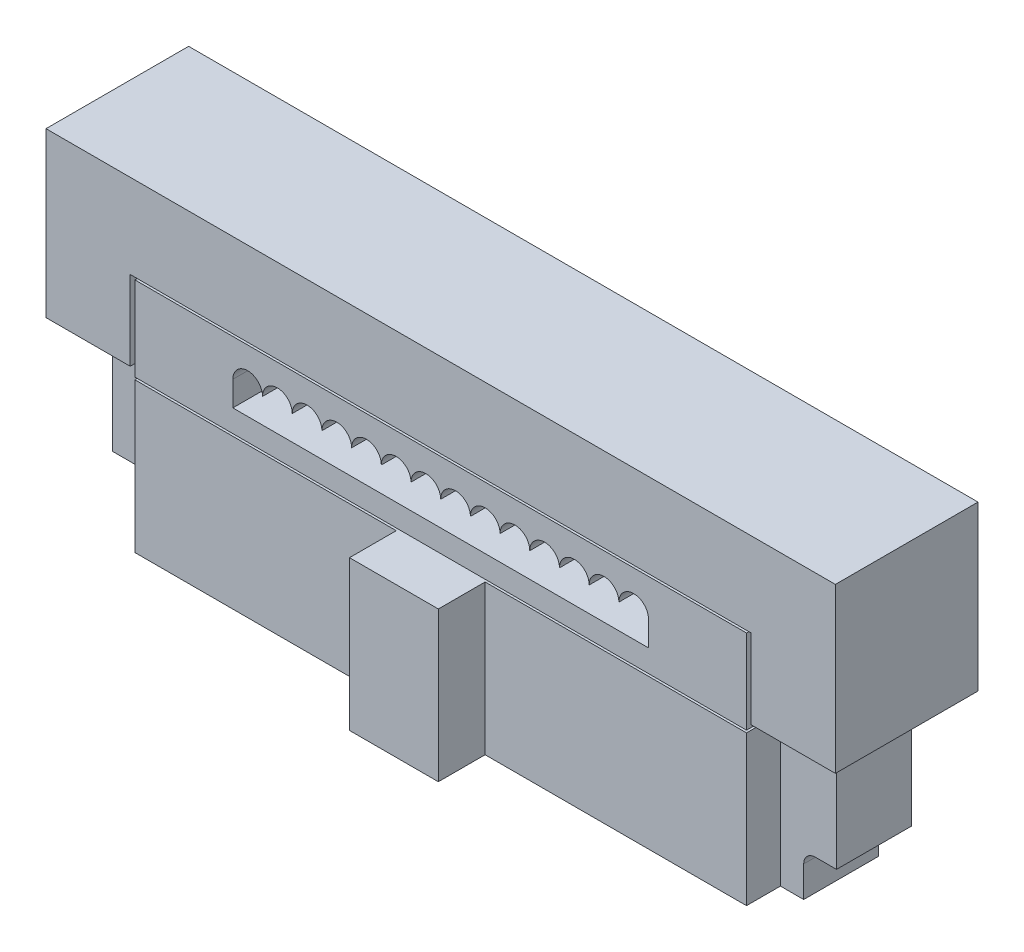
from build123d import *

# Parameters (mm, degrees)
SKETCH1_W            = 13.08
SKETCH1_H            = 3.2
BOSS_EXTRUDE1_DEPTH  = 3.05
BOSS_EXTRUDE2_START  = -0.725
BOSS_EXTRUDE2_DEPTH  = 1.6
SKETCH4_W            = 1.9
SKETCH4_H            = 3.2
POLARIZING_KEY_DEPTH = 1
SKETCH5_W            = 13.08
SKETCH5_H            = 1.8
CABLE_CLIP_DEPTH     = 3.05
BOSS_EXTRUDE5_REACH  = 12.496


with BuildPart() as part:
    # Sketch1 → Boss-Extrude1 (new body)
    with BuildSketch(Plane.XY):
        with Locations((0, 1.6)):
            Rectangle(SKETCH1_W, SKETCH1_H)
    extrude(amount=-BOSS_EXTRUDE1_DEPTH)

    # Sketch2 → Boss-Extrude2 (add)
    with BuildSketch(Plane.XY.offset(BOSS_EXTRUDE2_START)):
        with BuildLine():
            Line((6.54, 0), (7.037478352, 0))
            Line((7.037478352, 0), (7.037478352, 0.659767292))
            ThreePointArc((7.037478352, 0.659767292), (7.110701657, 0.836543987), (7.287478352, 0.909767292))
            Line((7.287478352, 0.909767292), (7.74, 0.909767292))
            Line((7.74, 0.909767292), (7.74, 6.4))
            Line((7.74, 6.4), (6.941198514, 6.4))
            Line((6.941198514, 6.4), (6.941198514, 3.178710063))
            Line((6.941198514, 3.178710063), (6.54, 3.2))
            Line((6.54, 3.2), (6.54, 0))
        make_face()
        with BuildLine():
            Line((-6.54, 3.2), (-6.54, 0))
            Line((-6.54, 0), (-7.037478352, 0))
            Line((-7.037478352, 0), (-7.037478352, 0.659767292))
            ThreePointArc((-7.037478352, 0.659767292), (-7.110701657, 0.836543987), (-7.287478352, 0.909767292))
            Line((-7.287478352, 0.909767292), (-7.74, 0.909767292))
            Line((-7.74, 0.909767292), (-7.74, 6.4))
            Line((-7.74, 6.4), (-6.941198514, 6.4))
            Line((-6.941198514, 6.4), (-6.941198514, 3.178710063))
            Line((-6.941198514, 3.178710063), (-6.54, 3.2))
        make_face()
    extrude(amount=-BOSS_EXTRUDE2_DEPTH)

    # Sketch4 → Polarizing key (add)
    with BuildSketch(Plane.XY):
        with Locations((0, 1.6)):
            Rectangle(SKETCH4_W, SKETCH4_H)
    extrude(amount=POLARIZING_KEY_DEPTH)

    # Boss-Extrude5: up to this face of the body (flat: up to its plane)
    boss_extrude5_end = Plane(part.part.faces().sort_by_distance((0, 1.6, -3.05))[0])
    # Sketch6 → Boss-Extrude5 (add, up to the picked face)
    with BuildSketch(Plane.XY, mode=Mode.PRIVATE) as boss_extrude5_sk1:
        Polygon((-8.44, 3.4), (-6.64, 3.4), (-6.64, 5.1), (6.64, 5.1), (6.64, 3.4), (8.44, 3.4), (8.44, 6.9), (-8.44, 6.9), align=None)
    boss_extrude5_tool1 = split(extrude(boss_extrude5_sk1.sketch, amount=-BOSS_EXTRUDE5_REACH, mode=Mode.PRIVATE), bisect_by=boss_extrude5_end, keep=Keep.BOTH, mode=Mode.PRIVATE)
    add(boss_extrude5_tool1.solids().sort_by(Axis((0, 5.706607, 0), (0, 0, -1)))[0])


with BuildPart() as body_2:
    # Sketch5 → Cable clip (new body)
    with BuildSketch(Plane.XY):
        with Locations((0, 4.15)):
            Rectangle(SKETCH5_W, SKETCH5_H)
        with BuildLine():
            Line((-4.445, 3.72625), (4.445, 3.72625))
            Line((4.445, 3.72625), (4.445, 4.25625))
            ThreePointArc((4.445, 4.25625), (4.1275, 4.57375), (3.81, 4.25625))
            ThreePointArc((3.81, 4.25625), (3.4925, 4.57375), (3.175, 4.25625))
            ThreePointArc((3.175, 4.25625), (2.8575, 4.57375), (2.54, 4.25625))
            ThreePointArc((2.54, 4.25625), (2.2225, 4.57375), (1.905, 4.25625))
            ThreePointArc((1.905, 4.25625), (1.5875, 4.57375), (1.27, 4.25625))
            ThreePointArc((1.27, 4.25625), (0.9525, 4.57375), (0.635, 4.25625))
            ThreePointArc((0.635, 4.25625), (0.3175, 4.57375), (0, 4.25625))
            ThreePointArc((0, 4.25625), (-0.3175, 4.57375), (-0.635, 4.25625))
            ThreePointArc((-0.635, 4.25625), (-0.9525, 4.57375), (-1.27, 4.25625))
            ThreePointArc((-1.27, 4.25625), (-1.5875, 4.57375), (-1.905, 4.25625))
            ThreePointArc((-1.905, 4.25625), (-2.2225, 4.57375), (-2.54, 4.25625))
            ThreePointArc((-2.54, 4.25625), (-2.8575, 4.57375), (-3.175, 4.25625))
            ThreePointArc((-3.175, 4.25625), (-3.4925, 4.57375), (-3.81, 4.25625))
            ThreePointArc((-3.81, 4.25625), (-4.1275, 4.57375), (-4.445, 4.25625))
            Line((-4.445, 4.25625), (-4.445, 3.72625))
        make_face(mode=Mode.SUBTRACT)
    extrude(amount=-CABLE_CLIP_DEPTH)


solid = Compound([part.part, body_2.part])
